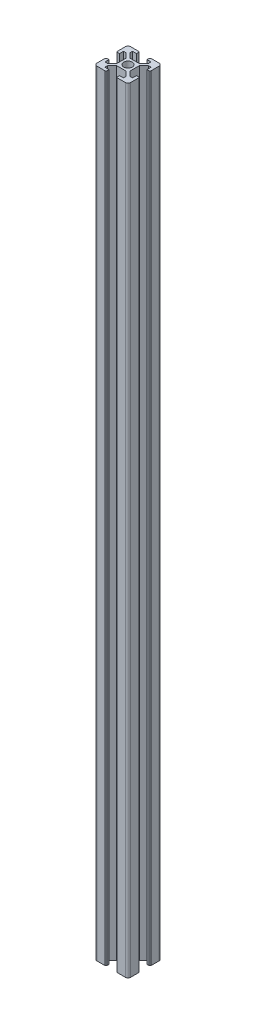
from build123d import *

# Parameters (mm, degrees)
EXTRUDE_2_DEPTH     = 460
SKETCH_4_R          = 2.55
CUT_EXTRUDE_2_DEPTH = 461.868744872


with BuildPart() as part:
    # 草图1 → 凸台-拉伸2 (new body)
    with BuildSketch(Plane(origin=(0, 0, 0), x_dir=(1, 0, 0), z_dir=(0, 1, 0))):
        with BuildLine():
            Line((13.9, 12.839339828), (13.9, 7.160660172))
            Line((13.9, 7.160660172), (16.560660172, 4.5))
            Line((16.560660172, 4.5), (18.2, 4.5))
            Line((18.2, 4.5), (18.2, 6.9))
            Line((18.2, 6.9), (19.5, 6.9))
            Line((19.5, 6.9), (20, 6.4))
            Line((20, 6.4), (20, 1.5))
            ThreePointArc((20, 1.5), (19.560660172, 0.439339828), (18.5, 0))
            Line((18.5, 0), (13.6, 0))
            Line((13.6, 0), (13.1, 0.5))
            Line((13.1, 0.5), (13.1, 1.8))
            Line((13.1, 1.8), (15.5, 1.8))
            Line((15.5, 1.8), (15.5, 3.439339828))
            Line((15.5, 3.439339828), (12.839339828, 6.1))
            Line((12.839339828, 6.1), (7.160660172, 6.1))
            Line((7.160660172, 6.1), (4.5, 3.439339828))
            Line((4.5, 3.439339828), (4.5, 1.8))
            Line((4.5, 1.8), (6.9, 1.8))
            Line((6.9, 1.8), (6.9, 0.5))
            Line((6.9, 0.5), (6.4, 0))
            Line((6.4, 0), (1.5, 0))
            ThreePointArc((1.5, 0), (0.439339828, 0.439339828), (0, 1.5))
            Line((0, 1.5), (0, 6.4))
            Line((0, 6.4), (0.5, 6.9))
            Line((0.5, 6.9), (1.8, 6.9))
            Line((1.8, 6.9), (1.8, 4.5))
            Line((1.8, 4.5), (3.439339828, 4.5))
            Line((3.439339828, 4.5), (6.1, 7.160660172))
            Line((6.1, 7.160660172), (6.1, 12.839339828))
            Line((6.1, 12.839339828), (3.439339828, 15.5))
            Line((3.439339828, 15.5), (1.8, 15.5))
            Line((1.8, 15.5), (1.8, 13.1))
            Line((1.8, 13.1), (0.5, 13.1))
            Line((0.5, 13.1), (0, 13.6))
            Line((0, 13.6), (0, 18.5))
            ThreePointArc((0, 18.5), (0.439339828, 19.560660172), (1.5, 20))
            Line((1.5, 20), (6.4, 20))
            Line((6.4, 20), (6.9, 19.5))
            Line((6.9, 19.5), (6.9, 18.2))
            Line((6.9, 18.2), (4.5, 18.2))
            Line((4.5, 18.2), (4.5, 16.560660172))
            Line((4.5, 16.560660172), (7.160660172, 13.9))
            Line((7.160660172, 13.9), (12.839339828, 13.9))
            Line((12.839339828, 13.9), (15.5, 16.560660172))
            Line((15.5, 16.560660172), (15.5, 18.2))
            Line((15.5, 18.2), (13.1, 18.2))
            Line((13.1, 18.2), (13.1, 19.5))
            Line((13.1, 19.5), (13.6, 20))
            Line((13.6, 20), (18.5, 20))
            ThreePointArc((18.5, 20), (19.560660172, 19.560660172), (20, 18.5))
            Line((20, 18.5), (20, 13.6))
            Line((20, 13.6), (19.5, 13.1))
            Line((19.5, 13.1), (18.2, 13.1))
            Line((18.2, 13.1), (18.2, 15.5))
            Line((18.2, 15.5), (16.560660172, 15.5))
            Line((16.560660172, 15.5), (13.9, 12.839339828))
        make_face()
    extrude(amount=EXTRUDE_2_DEPTH)

    # 草图4 → 切除-拉伸2 (cut, through all)
    with BuildSketch(Plane.XZ):
        with Locations(Location((10, -10, 0), (0, 0, 270))):
            Circle(SKETCH_4_R)
    extrude(amount=-CUT_EXTRUDE_2_DEPTH, mode=Mode.SUBTRACT)


solid = part.part
